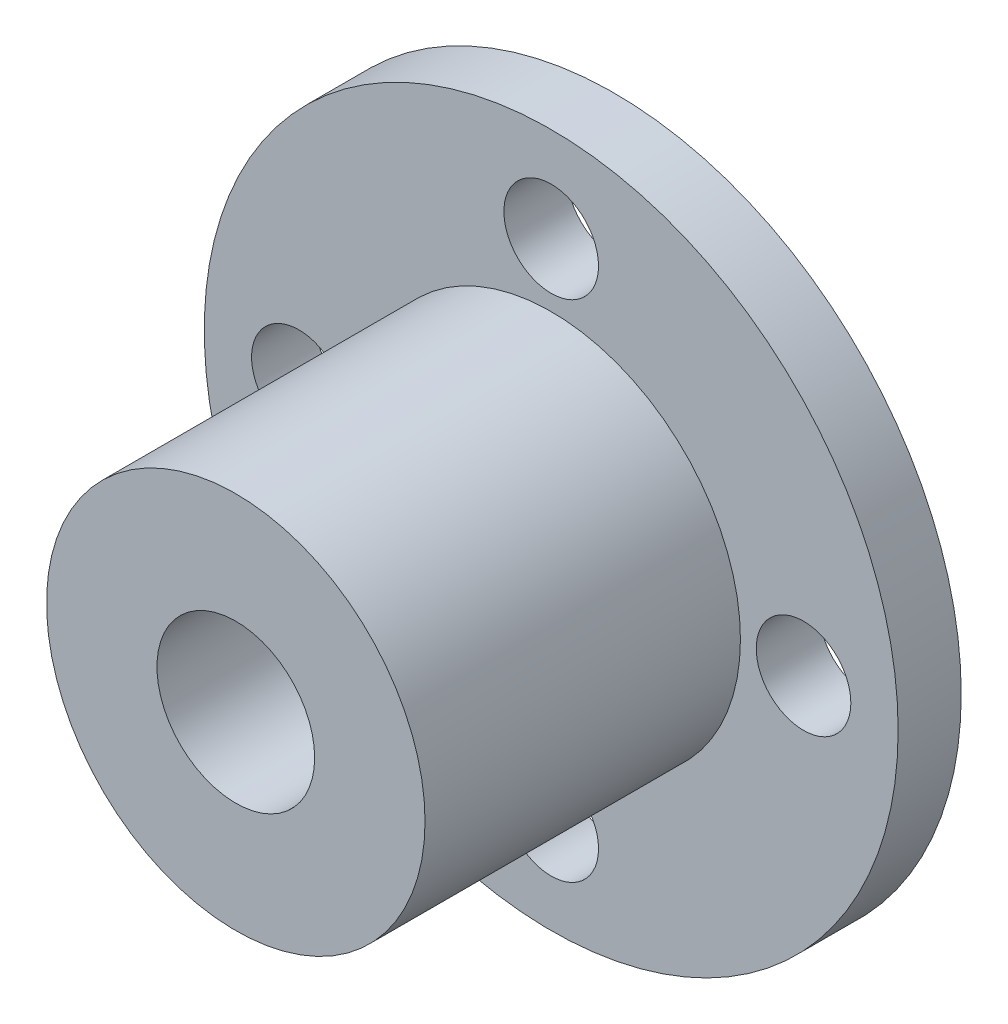
from build123d import *

# Parameters (mm, degrees)
SKETCH1_R           = 11
BOSS_EXTRUDE1_DEPTH = 2
SKETCH2_R           = 6
BOSS_EXTRUDE2_DEPTH = 10
SKETCH3_R           = 2.5
CUT_EXTRUDE1_DEPTH  = 20.646882704
SKETCH5_R           = 1.5
CUT_EXTRUDE2_DEPTH  = 19.493242009


with BuildPart() as part:
    # Sketch1 → Boss-Extrude1 (new body)
    with BuildSketch(Plane.XY):
        Circle(SKETCH1_R)
    extrude(amount=BOSS_EXTRUDE1_DEPTH)

    # Sketch2 → Boss-Extrude2 (add)
    with BuildSketch(Plane.XY.offset(2)):
        Circle(SKETCH2_R)
    extrude(amount=BOSS_EXTRUDE2_DEPTH)

    # Sketch3 → Cut-Extrude1 (cut, through all)
    with BuildSketch(Plane.XY.offset(12)):
        Circle(SKETCH3_R)
    extrude(amount=-CUT_EXTRUDE1_DEPTH, mode=Mode.SUBTRACT)

    # Sketch5 → Cut-Extrude2 (cut, through all)
    with BuildSketch(Plane.XY.offset(2)):
        with Locations((0, 8)):
            Circle(SKETCH5_R)
        with Locations((8, 0)):
            Circle(SKETCH5_R)
        with Locations((0, -8)):
            Circle(SKETCH5_R)
        with Locations((-8, 0)):
            Circle(SKETCH5_R)
    extrude(amount=-CUT_EXTRUDE2_DEPTH, mode=Mode.SUBTRACT)


solid = part.part
